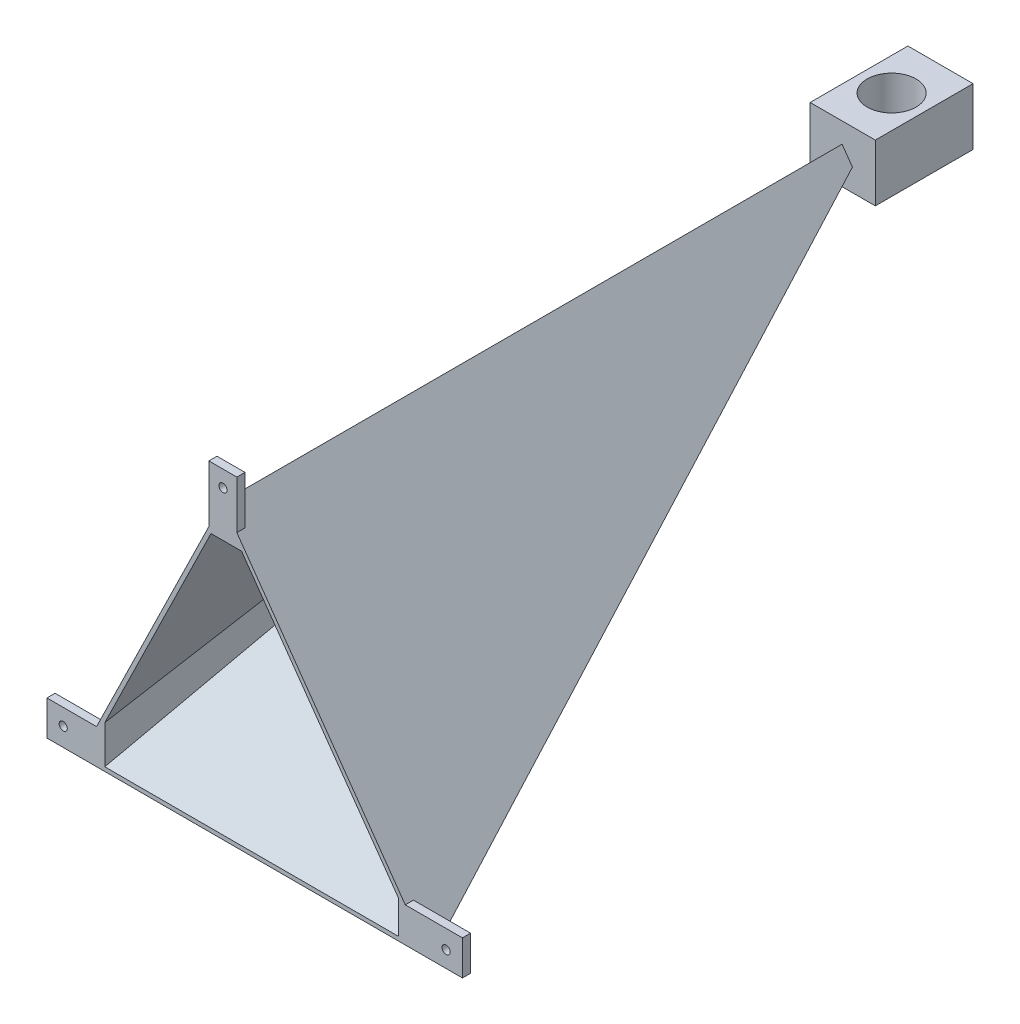
from build123d import *

# Parameters (mm, degrees)
ESBO_O7_W                = 40
ESBO_O7_H                = 35
CORTE_EXTRUS_O3_DEPTH    = 20
ESBO_O8_W                = 40
ESBO_O8_H                = 35
RESSALTO_EXTRUS_O1_DEPTH = 60
ESBO_O9_R                = 15
CORTE_EXTRUS_O4_DEPTH    = 30
ESBO_O10_W               = 60
ESBO_O10_H               = 42.668623852
CORTE_EXTRUS_O6_DEPTH    = 5
ESBO_O12_W               = 50
ESBO_O12_H               = 21.334311926
RESSALTO_EXTRUS_O3_DEPTH = 5
ESBO_O13_W               = 60
ESBO_O13_H               = 42.668623852
CORTE_EXTRUS_O8_DEPTH    = 5
ESBO_O14_W               = 50
ESBO_O14_H               = 21.334311926
RESSALTO_EXTRUS_O4_DEPTH = 5
ESBO_O15_W               = 17.17613937
ESBO_O15_H               = 45.233285306
CORTE_EXTRUS_O9_DEPTH    = 5
ESBO_O16_W               = 17.17613937
ESBO_O16_H               = 40
RESSALTO_EXTRUS_O5_DEPTH = 5
ESBO_O17_R               = 2.5
CORTE_EXTRUS_O10_DEPTH   = 10
ESBO_O21_R               = 2.5
CORTE_EXTRUS_O11_DEPTH   = 519.156686831


with BuildPart() as part:
    # Esboço2 → Loft1 section 0
    with BuildSketch(Plane.XY, mode=Mode.PRIVATE) as loft1_s0:
        with BuildLine():
            Line((-10.863095238, 0), (204.136904762, 0))
            Line((204.136904762, 0), (77.102021041, 179.616642653))
            Line((77.102021041, 179.616642653), (-10.863095238, 0))
        make_face()
    loft([Vertex(77.102021041, 179.616642653, -400), loft1_s0.sketch])

    # Esboço7 → Corte-extrusão3 (cut)
    with BuildSketch(Plane(origin=(77.102021041, 179.616642653, -400), x_dir=(1, 0, 0), z_dir=(0, 0, 1))):
        Rectangle(ESBO_O7_W, ESBO_O7_H)
    extrude(amount=CORTE_EXTRUS_O3_DEPTH, mode=Mode.SUBTRACT)

    # Esboço8 → Ressalto-extrusão1 (add)
    with BuildSketch(Plane(origin=(0, 0, -380), x_dir=(-1, 0, 0), z_dir=(0, 0, -1))):
        with Locations((-77.5, 174.5)):
            Rectangle(ESBO_O8_W, ESBO_O8_H)
    extrude(amount=RESSALTO_EXTRUS_O1_DEPTH)

    # Esboço9 → Corte-extrusão4 (cut)
    with BuildSketch(Plane(origin=(0, 192, 0), x_dir=(1, 0, 0), z_dir=(0, 1, 0))):
        with Locations((77.5, 410)):
            Circle(ESBO_O9_R)
    extrude(amount=-CORTE_EXTRUS_O4_DEPTH, mode=Mode.SUBTRACT)

    # Esboço10 → Corte-extrusão6 (cut)
    with BuildSketch(Plane.XY):
        with Locations((-10.863095238, 0)):
            Rectangle(ESBO_O10_W, ESBO_O10_H)
    extrude(amount=-CORTE_EXTRUS_O6_DEPTH, mode=Mode.SUBTRACT)

    # Esboço12 → Ressalto-extrusão3 (add)
    with BuildSketch(Plane.XY.offset(-5)):
        with Locations((-5.863095238, 10.667155963)):
            Rectangle(ESBO_O12_W, ESBO_O12_H)
    extrude(amount=RESSALTO_EXTRUS_O3_DEPTH)

    # Esboço13 → Corte-extrusão8 (cut)
    with BuildSketch(Plane.XY):
        with Locations((204.136904762, 0)):
            Rectangle(ESBO_O13_W, ESBO_O13_H)
    extrude(amount=-CORTE_EXTRUS_O8_DEPTH, mode=Mode.SUBTRACT)

    # Esboço14 → Ressalto-extrusão4 (add)
    with BuildSketch(Plane.XY.offset(-5)):
        with Locations((199.136904762, 10.667155963)):
            Rectangle(ESBO_O14_W, ESBO_O14_H)
    extrude(amount=RESSALTO_EXTRUS_O4_DEPTH)

    # Esboço15 → Corte-extrusão9 (cut)
    with BuildSketch(Plane.XY):
        with Locations((77.102021041, 179.616642653)):
            Rectangle(ESBO_O15_W, ESBO_O15_H)
    extrude(amount=-CORTE_EXTRUS_O9_DEPTH, mode=Mode.SUBTRACT)

    # Esboço16 → Ressalto-extrusão5 (add)
    with BuildSketch(Plane.XY.offset(-5)):
        with Locations((77.102021041, 177)):
            Rectangle(ESBO_O16_W, ESBO_O16_H)
    extrude(amount=RESSALTO_EXTRUS_O5_DEPTH)

    # Esboço17 → Corte-extrusão10 (cut)
    with BuildSketch(Plane.XY):
        with Locations((-20.863095238, 11.334311926)):
            Circle(ESBO_O17_R)
        with Locations((214.136904762, 10)):
            Circle(ESBO_O17_R)
        with Locations((77.190090726, 187)):
            Circle(ESBO_O17_R)
    extrude(amount=-CORTE_EXTRUS_O10_DEPTH, mode=Mode.SUBTRACT)

    # Esboço20 → Loft de corte2 section 0
    with BuildSketch(Plane.XY, mode=Mode.PRIVATE) as loft_de_corte2_s0:
        with BuildLine():
            Line((4.64946483, 2.5), (184.871981239, 2.5))
            Line((184.871981239, 2.5), (184.871981239, 22.909462338))
            Line((184.871981239, 22.909462338), (88.571698608, 159.069963659))
            Line((88.571698608, 159.069963659), (69.823235581, 159.069963659))
            Line((69.823235581, 159.069963659), (4.64946483, 25.99114348))
            Line((4.64946483, 25.99114348), (4.64946483, 2.5))
        make_face()
    loft([loft_de_corte2_s0.sketch, Vertex(77.102021041, 179.616642653, -400)], mode=Mode.SUBTRACT)

    # Esboço21 → Corte-extrusão11 (cut, through all)
    with BuildSketch(Plane.XZ.offset(-157)):
        with Locations((77.5, -410)):
            Circle(ESBO_O21_R)
    extrude(amount=-CORTE_EXTRUS_O11_DEPTH, mode=Mode.SUBTRACT)


solid = part.part
